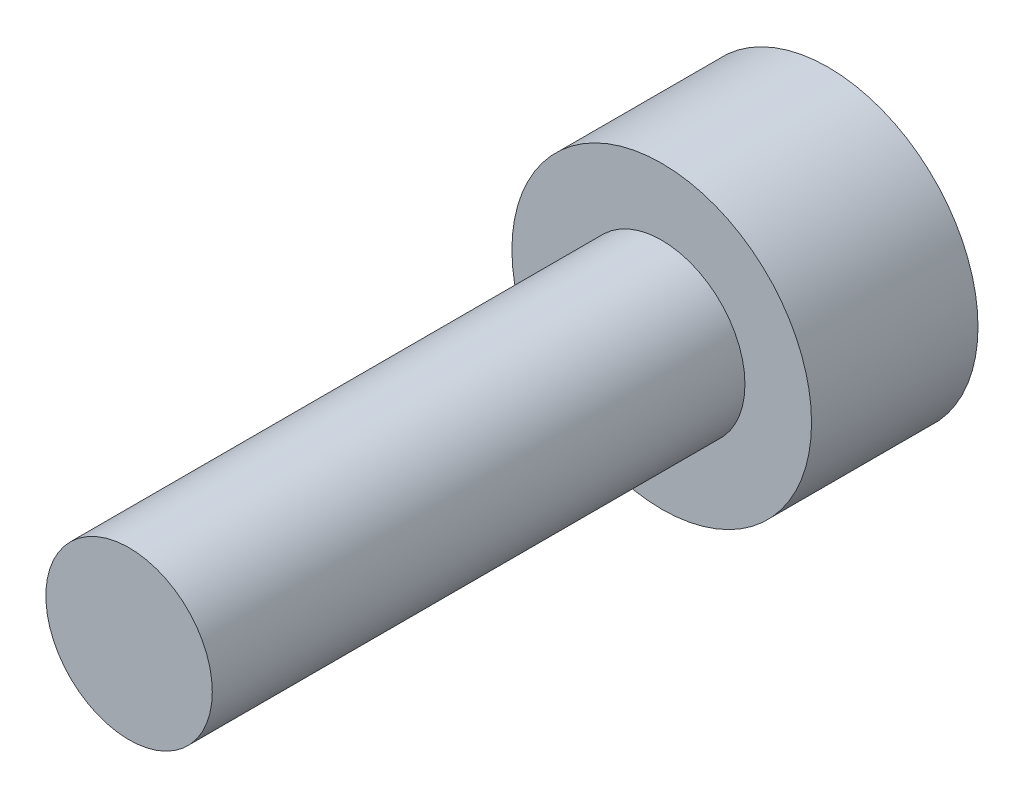
from build123d import *

# Parameters (mm, degrees)
SKETCH_1_R          = 2.25
EXTRUDE_1_DEPTH     = 2.5
SKETCH_2_R          = 1.25
EXTRUDE_2_DEPTH     = 8
CUT_EXTRUDE_1_DEPTH = 2


with BuildPart() as part:
    # ｽｹｯﾁ1 → ﾎﾞｽ - 押し出し1 (new body)
    with BuildSketch(Plane.XY):
        Circle(SKETCH_1_R)
    extrude(amount=EXTRUDE_1_DEPTH)

    # ｽｹｯﾁ2 → ﾎﾞｽ - 押し出し2 (add)
    with BuildSketch(Plane.XY.offset(2.5)):
        Circle(SKETCH_2_R)
    extrude(amount=EXTRUDE_2_DEPTH)

    # ｽｹｯﾁ3 → ｶｯﾄ - 押し出し1 (cut)
    with BuildSketch(Plane(origin=(0, 0, 0), x_dir=(-1, 0, 0), z_dir=(0, 0, -1))):
        Polygon((0.852242502, -0.763657679), (1.087468201, 0.356234818), (0.235225699, 1.119892496), (-0.852242502, 0.763657679), (-1.087468201, -0.356234818), (-0.235225699, -1.119892496), align=None)
    extrude(amount=-CUT_EXTRUDE_1_DEPTH, mode=Mode.SUBTRACT)


solid = part.part
